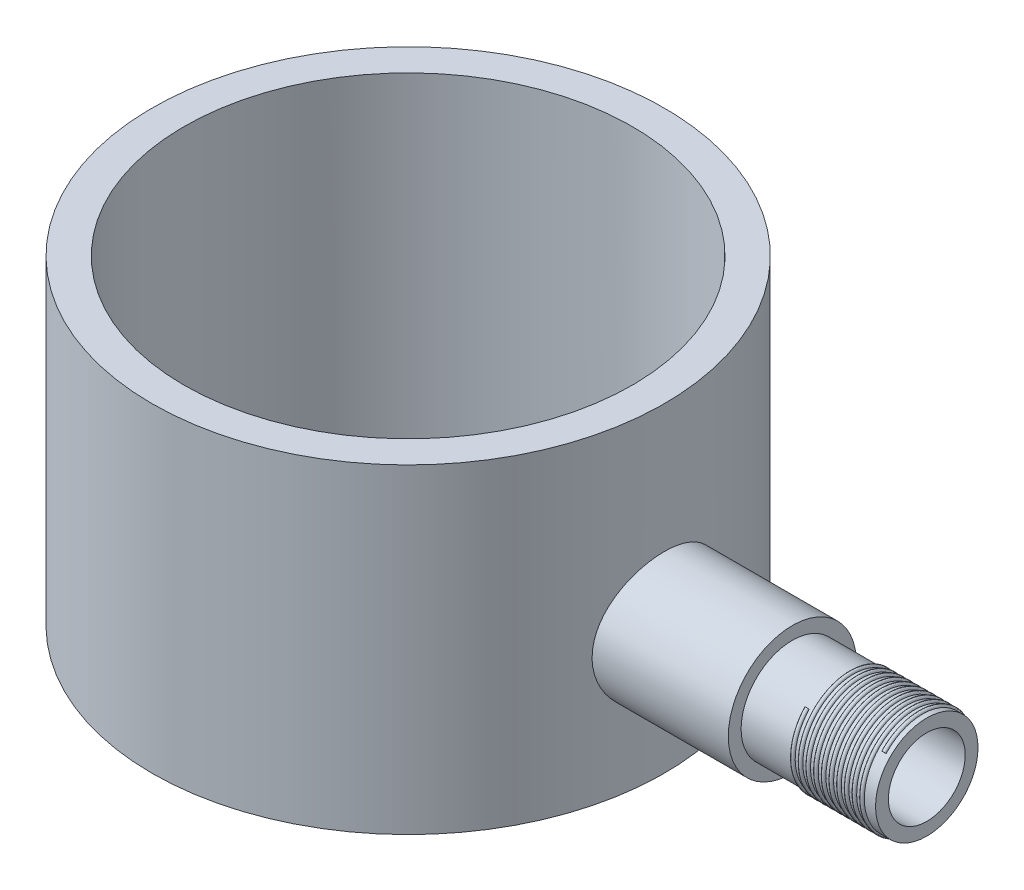
from build123d import *

# Parameters (mm, degrees)
SKETCH2_R           = 40
SKETCH2_R_2         = 35
BOSS_EXTRUDE1_DEPTH = 50
BOSS_EXTRUDE2_DEPTH = 6
SKETCH4_R           = 1.5
CUT_EXTRUDE2_DEPTH  = 6
CUT_EXTRUDE6_START  = -60
SKETCH12_R          = 6
CUT_EXTRUDE6_DEPTH  = 60
SWEEP1_PITCH        = 1.2
SWEEP1_HEIGHT       = 12
SWEEP1_RADIUS       = 8
SWEEP1_START_ANGLE  = -135
SWEEP1_PROFILE_R    = 0.3
BOSS_EXTRUDE3_START = 1
SKETCH30_R          = 8
BOSS_EXTRUDE3_DEPTH = 1
CUT_EXTRUDE7_START  = -1
SKETCH31_R          = 6
CUT_EXTRUDE7_DEPTH  = 1


with BuildPart() as part:
    # Sketch2 → Boss-Extrude1 (new body)
    with BuildSketch(Plane(origin=(0, 0, 0), x_dir=(1, 0, 0), z_dir=(0, 1, 0))):
        with Locations(Location((0, 0, 0), (0, 0, 270))):
            Circle(SKETCH2_R)
        with Locations(Location((0, 0, 0), (0, 0, 270))):
            Circle(SKETCH2_R_2, mode=Mode.SUBTRACT)
    extrude(amount=BOSS_EXTRUDE1_DEPTH)

    # Sketch3 → Boss-Extrude2 (add)
    with BuildSketch(Plane(origin=(0, 0, 0), x_dir=(-1, 0, 0), z_dir=(0, -1, 0))):
        with BuildLine():
            Line((-2, -35), (1.993849139, -35))
            Line((1.993849139, -35), (1.993849139, -20.905132518))
            ThreePointArc((1.993849139, -20.905132518), (14.847057687, -14.851426801), (20.90454496, -2))
            Line((20.90454496, -2), (34.993849139, -2))
            Line((34.993849139, -2), (34.993849139, 2))
            Line((34.993849139, 2), (20.90454496, 2))
            ThreePointArc((20.90454496, 2), (14.849242405, 14.849242405), (2, 20.90454496))
            Line((2, 20.90454496), (2, 35))
            Line((2, 35), (-2, 35))
            Line((-2, 35), (-2, 20.90454496))
            ThreePointArc((-2, 20.90454496), (-14.849242405, 14.849242405), (-20.90454496, 2))
            Line((-20.90454496, 2), (-35, 2))
            Line((-35, 2), (-35, -2))
            Line((-35, -2), (-20.90454496, -2))
            ThreePointArc((-20.90454496, -2), (-14.849242405, -14.849242405), (-2, -20.90454496))
            Line((-2, -20.90454496), (-2, -35))
        make_face()
    extrude(amount=-BOSS_EXTRUDE2_DEPTH)

    # Sketch4 → Cut-Extrude2 (cut)
    with BuildSketch(Plane(origin=(0, 0, 0), x_dir=(-1, 0, 0), z_dir=(0, -1, 0))):
        with Locations(Location((-8, 0, 0), (0, 0, 90))):
            Circle(SKETCH4_R)
        with Locations(Location((8, 0, 0), (0, 0, 90))):
            Circle(SKETCH4_R)
        with Locations(Location((0, -9.5, 0), (0, 0, 90))):
            Circle(SKETCH4_R)
        with Locations(Location((0, 9.5, 0), (0, 0, 90))):
            Circle(SKETCH4_R)
        with Locations(Location((0, -16.25, 0), (0, 0, 90))):
            Circle(SKETCH4_R)
        with Locations(Location((-16.25, 0, 0), (0, 0, 90))):
            Circle(SKETCH4_R)
        with Locations(Location((0, 16.25, 0), (0, 0, 90))):
            Circle(SKETCH4_R)
        with Locations(Location((16.25, 0, 0), (0, 0, 90))):
            Circle(SKETCH4_R)
    extrude(amount=-CUT_EXTRUDE2_DEPTH, mode=Mode.SUBTRACT)

    # Sketch5 → Revolve4 (revolve)
    with BuildSketch(Plane.XY, mode=Mode.PRIVATE) as revolve4_sk:
        Polygon((80, 14), (38, 14), (38, 10), (60, 10), (60, 12), (80, 12), align=None)
    revolve(revolve4_sk.sketch.rotate(Axis((0, 20, 0), (1, 0, 0)), 270), axis=Axis((0, 20, 0), (1, 0, 0)))

    # Sketch12 → Cut-Extrude6 (cut)
    with BuildSketch(Plane(origin=(80, 0, 0), x_dir=(0, 0, -1), z_dir=(1, 0, 0)).offset(CUT_EXTRUDE6_START)):
        with Locations(Location((0, 20, 0), (0, 0, 180))):
            Circle(SKETCH12_R)
    extrude(amount=CUT_EXTRUDE6_DEPTH, mode=Mode.SUBTRACT)

    # Sweep1: sweep along a helix
    with BuildLine() as sweep1_path:
        add(Helix(SWEEP1_PITCH, SWEEP1_HEIGHT, SWEEP1_RADIUS, center=(80, 20, 0), direction=(-1, 0, 0), mode=Mode.PRIVATE).rotate(Axis((80, 20, 0), (-1, 0, 0)), SWEEP1_START_ANGLE))
    # Sweep1 profile (on start of the path) → Sweep1 (sweep)
    with BuildSketch(Plane(origin=(80, 25.656854249, 5.656854249), x_dir=(0, -0.707106781186614, -0.7071067811864813), z_dir=(-0.023866441315373417, 0.7069053660069191, -0.7069053660070517))):
        Circle(SWEEP1_PROFILE_R)
    sweep(path=sweep1_path.line, is_frenet=True)

    # Sketch30 → Boss-Extrude3 (add)
    with BuildSketch(Plane(origin=(80, 0, 0), x_dir=(0, 0, -1), z_dir=(1, 0, 0)).offset(BOSS_EXTRUDE3_START)):
        with Locations(Location((0, 20, 0), (0, 0, 180))):
            Circle(SKETCH30_R)
    extrude(amount=-BOSS_EXTRUDE3_DEPTH)

    # Sketch31 → Cut-Extrude7 (cut)
    with BuildSketch(Plane(origin=(81, 0, 0), x_dir=(0, 0, -1), z_dir=(1, 0, 0)).offset(CUT_EXTRUDE7_START)):
        with Locations((0, 20)):
            Circle(SKETCH31_R)
    extrude(amount=CUT_EXTRUDE7_DEPTH, mode=Mode.SUBTRACT)


solid = part.part
